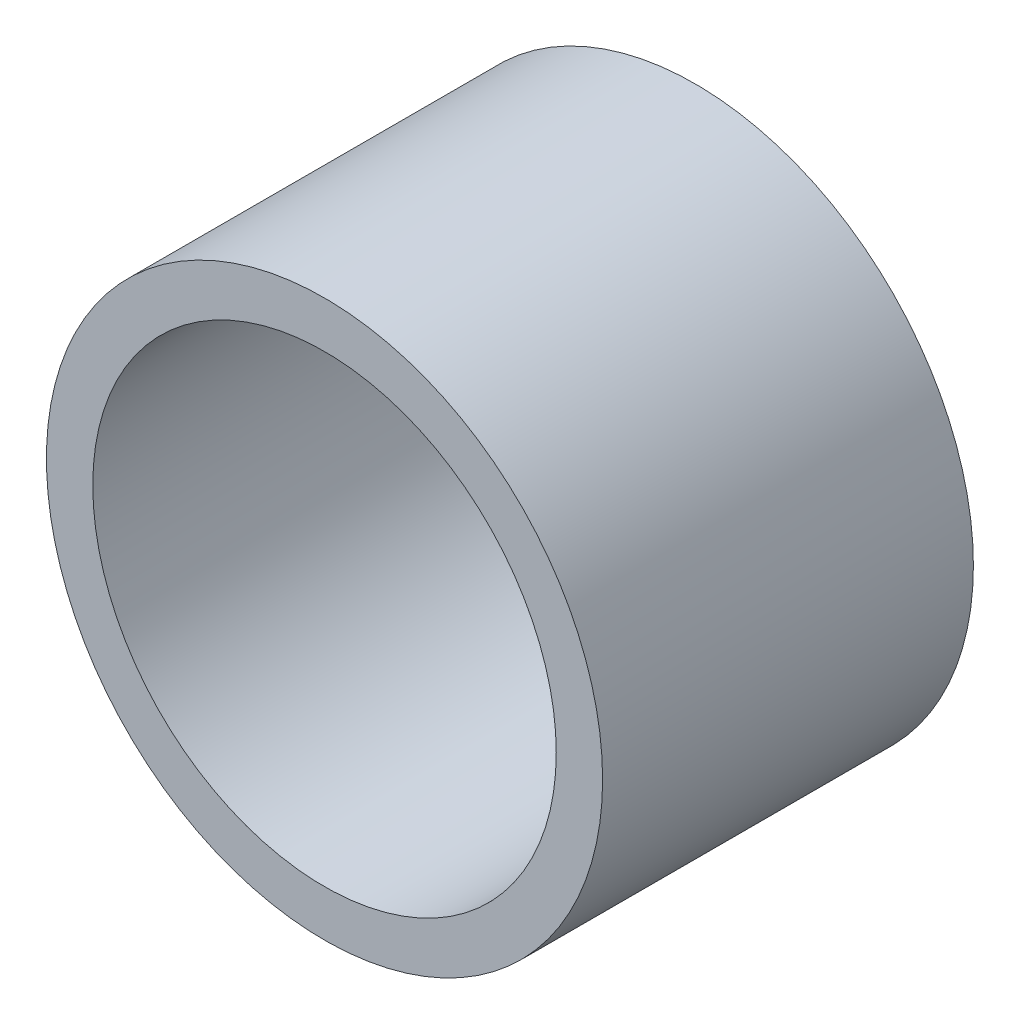
from build123d import *

# Parameters (mm, degrees)
SKETCH_1_R      = 6
SKETCH_1_R_2    = 5
EXTRUDE_1_DEPTH = 8


with BuildPart() as part:
    # 草图1 → 凸台-拉伸1 (new body)
    with BuildSketch(Plane.XY):
        Circle(SKETCH_1_R)
        Circle(SKETCH_1_R_2, mode=Mode.SUBTRACT)
    extrude(amount=EXTRUDE_1_DEPTH)


solid = part.part
